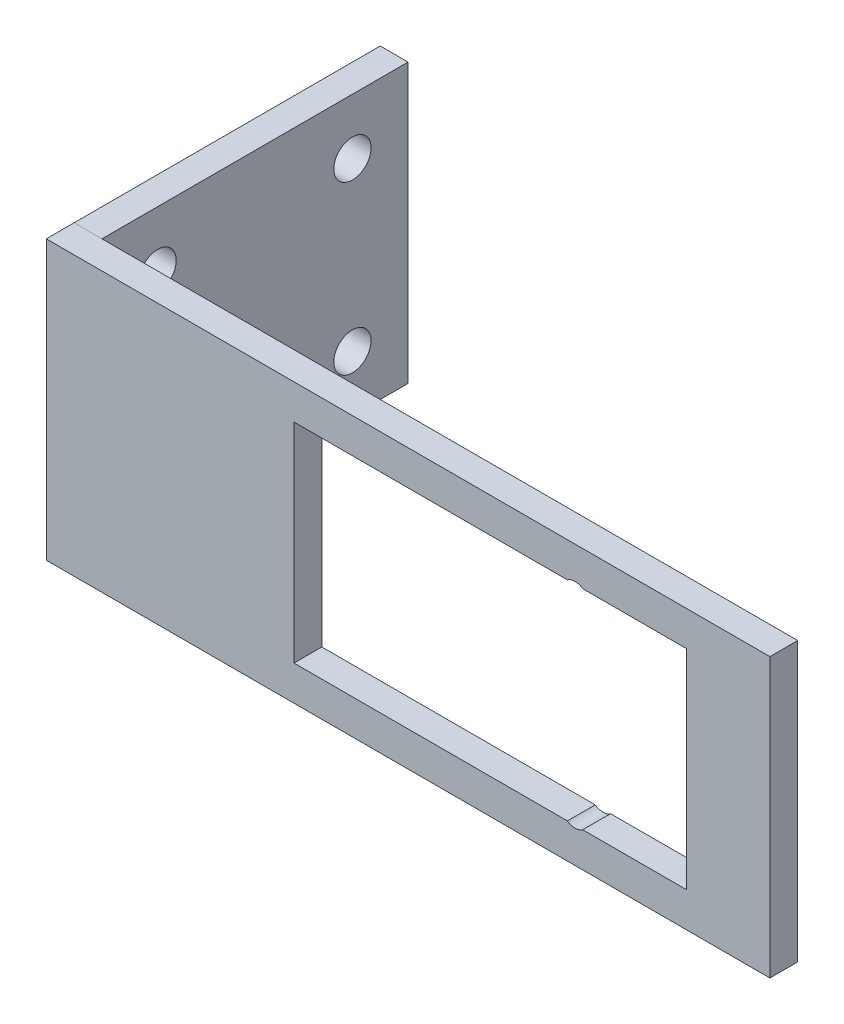
from build123d import *

# Parameters (mm, degrees)
SKETCH1_W                           = 27.94
SKETCH1_H                           = 25.4
SIDE_CONNECTING_TO_GRIP_DEPTH       = 2.54
M3_CLEARANCE_HOLE1_D                = 3.4
SIDE_CONNECTING_TO_SERVO_DEPTH      = 63.5
SIDE_CONNECTING_TO_SERVO_DEPTH_BACK = 2.54
SKETCH6_W                           = 2.54
SKETCH6_H                           = 25.4
SKETCH9_W                           = 1.2
SKETCH9_H                           = 30.48
CUTOUT_SERVO_HOLES_AT_2_COUNT       = 2
CUTOUT_SERVO_HOLES_AT_2_PITCH       = 17.1
SKETCH10_W                          = 35.814
SKETCH10_H                          = 19.05
CUT_EXTRUDE1_DEPTH                  = 2.54


with BuildPart() as part:
    # Sketch1 → side connecting to grip (new body)
    with BuildSketch(Plane(origin=(0, 0, 0), x_dir=(0, 0, -1), z_dir=(1, 0, 0))):
        with Locations((-31.87684378, 4.036305379)):
            Rectangle(SKETCH1_W, SKETCH1_H)
    extrude(amount=SIDE_CONNECTING_TO_GRIP_DEPTH)

    # M3 Clearance Hole1 (through all)
    with Locations(Plane(origin=(2.54, 0, 0), x_dir=(0, 0, -1), z_dir=(1, 0, 0))):
        with Locations((-40.76684378, 11.656305379), (-22.98684378, 11.656305379), (-22.98684378, -3.583694621), (-40.76684378, -3.583694621)):
            Hole(M3_CLEARANCE_HOLE1_D / 2)


with BuildPart() as body_2:
    # Sketch6 → side connecting to servo (new, two sides: drawn at the far end of the back side and taken through both)
    with BuildSketch(Plane(origin=(2.54, 0, 0), x_dir=(0, 0, -1), z_dir=(1, 0, 0)).offset(-SIDE_CONNECTING_TO_SERVO_DEPTH_BACK)):
        with Locations((-47.11684378, 4.036305379)):
            Rectangle(SKETCH6_W, SKETCH6_H)
    extrude(amount=SIDE_CONNECTING_TO_SERVO_DEPTH + SIDE_CONNECTING_TO_SERVO_DEPTH_BACK)

    # Sketch9 → cutout servo holes (revolve, cut)
    with BuildSketch(Plane(origin=(48.26, 12.586305379, 48.38684378), x_dir=(0, -1, 0), z_dir=(1, 0, 0))):
        with Locations((0.6, 15.24)):
            Rectangle(SKETCH9_W, SKETCH9_H)
    cutout_servo_holes = revolve(axis=Axis((48.26, 12.586305379, 54.73684378), (0, 0, -1)), mode=Mode.SUBTRACT)

    # cutout servo holes at 2: cutout servo holes ×2
    with Locations(*[(0, -i * CUTOUT_SERVO_HOLES_AT_2_PITCH, 0) for i in range(1, CUTOUT_SERVO_HOLES_AT_2_COUNT)]):
        add(cutout_servo_holes, mode=Mode.SUBTRACT)

    # Sketch10 → Cut-Extrude1 (cut)
    with BuildSketch(Plane.XY.offset(48.38684378)):
        with Locations((40.513, 4.036305379)):
            Rectangle(SKETCH10_W, SKETCH10_H)
    extrude(amount=-CUT_EXTRUDE1_DEPTH, mode=Mode.SUBTRACT)


solid = Compound([part.part, body_2.part])
